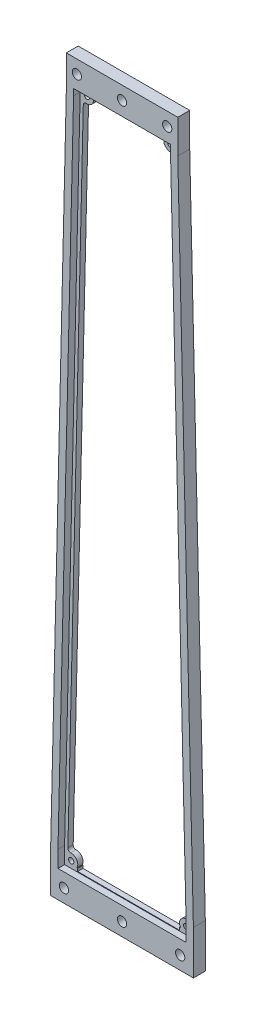
from build123d import *

# Parameters (mm, degrees)
SKETCH_2_R      = 1
EXTRUDE_1_DEPTH = 2
EXTRUDE_2_DEPTH = 2
EXTRUDE_3_DEPTH = 2.5
SKETCH_5_R      = 1.75
EXTRUDE_4_DEPTH = 4.5


with BuildPart() as part:
    # 草图2 → 凸台-拉伸1 (new body)
    with BuildSketch(Plane(origin=(0, 0, -1.538354077), x_dir=(-1, 0, 0), z_dir=(0, 0, -1))):
        with BuildLine():
            Line((-22.942959106, -124.662212149), (-17.134907671, 121.132350923))
            ThreePointArc((-17.134907671, 121.132350923), (-16.793190136, 121.861742775), (-16.024570953, 122.102591063))
            ThreePointArc((-16.024570953, 122.102591063), (-14.009380987, 122.790837638), (-13.255665128, 124.782466708))
            ThreePointArc((-13.255665128, 124.782466708), (-12.992914403, 125.539491489), (-12.25871858, 125.860553721))
            Line((-12.25871858, 125.860553721), (12.25871858, 125.860553721))
            ThreePointArc((12.25871858, 125.860553721), (12.992914403, 125.539491489), (13.255665128, 124.782466708))
            ThreePointArc((13.255665128, 124.782466708), (14.009380087, 122.79083851), (16.024568463, 122.102590786))
            ThreePointArc((16.024568463, 122.102590786), (16.793187022, 121.861742062), (17.134904184, 121.13235055))
            Line((17.134904184, 121.13235055), (22.942959106, -124.662212156))
            Line((22.942959106, -124.662212156), (22.942959106, -124.904555532))
            ThreePointArc((22.942959106, -124.904555532), (22.626864313, -125.634126411), (21.878411771, -125.902470178))
            ThreePointArc((21.878411771, -125.902470178), (19.586380534, -127.089481736), (19.565603095, -129.670561341))
            Line((19.565603095, -129.670561341), (19.265011022, -129.670561341))
            Line((19.265011022, -129.670561341), (19.265011022, -130.670561341))
            Line((19.265011022, -130.670561341), (23.942959106, -130.670561341))
            Line((23.942959106, -130.670561341), (23.942959106, -124.650398948))
            Line((23.942959106, -124.650398948), (18.052063488, 124.649948906))
            Line((18.052063488, 124.649948906), (18.052059944, 126.860553721))
            Line((18.052059944, 126.860553721), (-18.052059944, 126.860553721))
            Line((-18.052059944, 126.860553721), (-18.052059944, 124.65024892))
            Line((-18.052059944, 124.65024892), (-23.942959106, -124.650398948))
            Line((-23.942959106, -124.650398948), (-23.942959106, -130.670561341))
            Line((-23.942959106, -130.670561341), (-19.234988978, -130.670561341))
            Line((-19.234988978, -130.670561341), (-19.234988978, -129.670561341))
            Line((-19.234988978, -129.670561341), (-19.646017972, -129.670561341))
            ThreePointArc((-19.646017972, -129.670561341), (-19.548027097, -127.027128176), (-21.878411771, -125.775469924))
            ThreePointArc((-21.878411771, -125.775469924), (-22.626864313, -125.507126157), (-22.942959106, -124.777555278))
            Line((-22.942959106, -124.777555278), (-22.942959106, -124.662212149))
        make_face()
        with Locations((-21.717043434, -128.270256541)):
            Circle(SKETCH_2_R, mode=Mode.SUBTRACT)
        with Locations((21.717043434, -128.397256794)):
            Circle(SKETCH_2_R, mode=Mode.SUBTRACT)
        with Locations((-15.748031496, 124.587249174)):
            Circle(SKETCH_2_R, mode=Mode.SUBTRACT)
        with Locations((15.748031496, 124.587249174)):
            Circle(SKETCH_2_R, mode=Mode.SUBTRACT)
    extrude(amount=EXTRUDE_1_DEPTH)

    # 草图3 → 凸台-拉伸2 (add)
    with BuildSketch(Plane(origin=(0, 0, -3.538354077), x_dir=(-1, 0, 0), z_dir=(0, 0, -1))):
        Polygon((26.942959106, -124.614959326), (21.052063431, 124.685390934), (21.052055134, 129.860553721), (-21.052059944, 129.860553721), (-21.052059944, 124.685688522), (-26.942959106, -124.614959347), (-26.942959106, -133.670561341), (26.942959106, -133.670561341), align=None)
        Polygon((18.052059944, 126.860553721), (-18.052059944, 126.860553721), (-18.052059944, 124.65024892), (-23.942959106, -124.650398948), (-23.942959106, -130.670561341), (23.942959106, -130.670561341), (23.942959106, -124.650398948), (18.052063488, 124.649948906), align=None, mode=Mode.SUBTRACT)
    extrude(amount=-EXTRUDE_2_DEPTH)

    # 草图4 → 凸台-拉伸3 (add)
    with BuildSketch(Plane.XY.offset(-1.538354077)):
        Polygon((-21.052063431, 124.685390934), (-26.942959106, -124.614959326), (-26.942959106, -133.670561341), (26.942959106, -133.670561341), (26.942959106, -124.614959347), (21.052059944, 124.685688522), (21.052059944, 129.860553721), (-21.052055134, 129.860553721), align=None)
        Polygon((-18.302059543, 127.110553721), (-18.302063484, 124.652902409), (-24.192959106, -124.647445647), (-24.192959106, -130.920561341), (24.192959106, -130.920561341), (24.192959106, -124.647445648), (18.302059944, 124.653202221), (18.302059944, 127.110553721), align=None, mode=Mode.SUBTRACT)
    extrude(amount=EXTRUDE_3_DEPTH)

    # 草图5 → 凸台-拉伸4 (add)
    # profile 1 of 2: a face of its own
    with BuildSketch(Plane.XY.offset(0.961645923)):
        Polygon((-26.942959106, -133.670561341), (26.942959106, -133.670561341), (26.942959106, -138.670561341), (26.942959106, -141.170561341), (-26.942959106, -141.170561341), (-26.942959106, -138.670561341), align=None)
        with Locations((2.405e-06, -136.170561341)):
            Circle(SKETCH_5_R, mode=Mode.SUBTRACT)
        with Locations((21.942959106, -136.170561341)):
            Circle(SKETCH_5_R, mode=Mode.SUBTRACT)
        with Locations((-21.942959106, -136.170561341)):
            Circle(SKETCH_5_R, mode=Mode.SUBTRACT)
    # profile 2 of 2: a face of its own
    with BuildSketch(Plane.XY.offset(0.961645923)):
        Polygon((21.052059944, 129.860553721), (-21.052055134, 129.860553721), (-21.052055134, 134.860553721), (-21.052055134, 137.360553721), (21.052059944, 137.360553721), (21.052059944, 134.860553721), align=None)
        with Locations((-17.052055134, 132.360553721)):
            Circle(SKETCH_5_R, mode=Mode.SUBTRACT)
        with Locations((17.052059944, 132.360553721)):
            Circle(SKETCH_5_R, mode=Mode.SUBTRACT)
        with Locations((2.405e-06, 132.360553721)):
            Circle(SKETCH_5_R, mode=Mode.SUBTRACT)
    extrude(amount=-EXTRUDE_4_DEPTH)


solid = part.part
